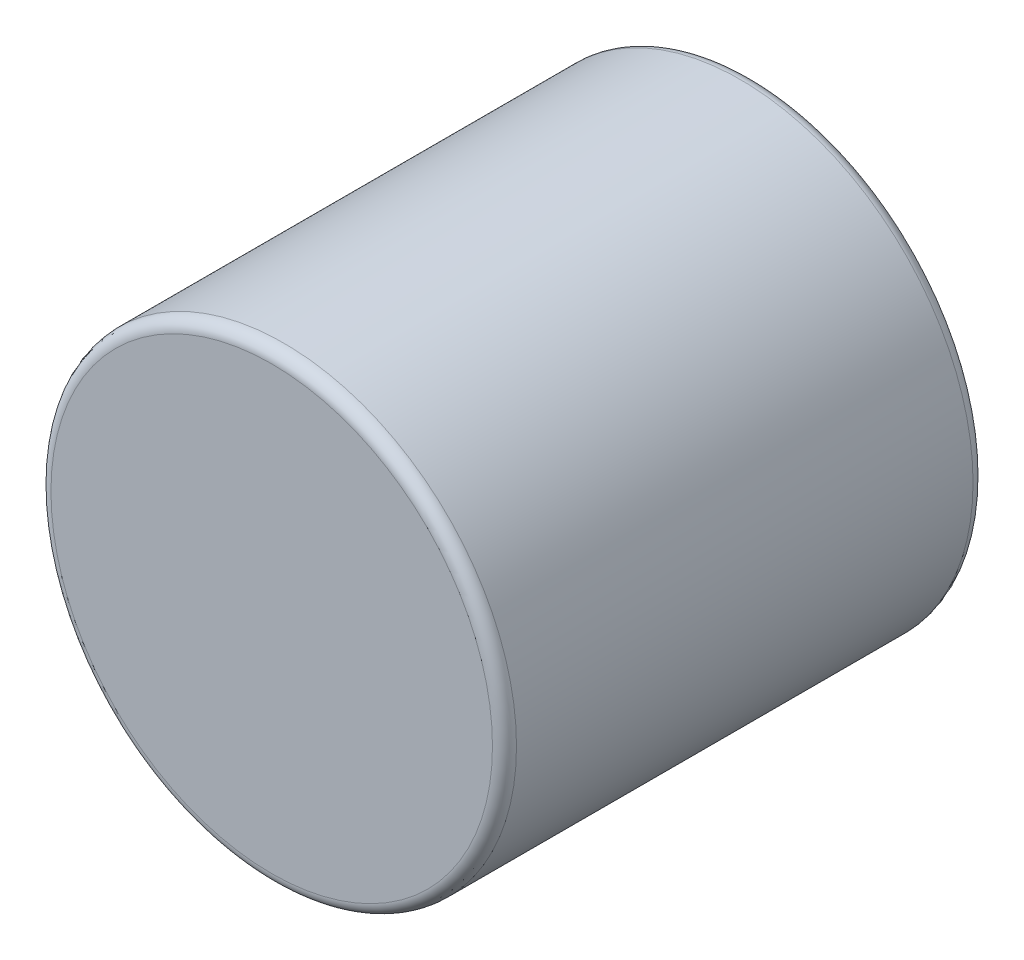
from build123d import *

# Parameters (mm, degrees)
SKETCH1_R           = 49.2125
BOSS_EXTRUDE1_DEPTH = 101.6
FILLET1_R           = 2.54


with BuildPart() as part:
    # Sketch1 → Boss-Extrude1 (new body)
    with BuildSketch(Plane.XY):
        Circle(SKETCH1_R)
    extrude(amount=BOSS_EXTRUDE1_DEPTH)

    # Fillet1
    fillet1_edges = [part.edges().sort_by_distance(p)[0] for p in [
        (-49.2125, 0, 0),
        (-49.2125, 0, 101.6),
    ]]
    fillet(fillet1_edges, radius=FILLET1_R)


solid = part.part
